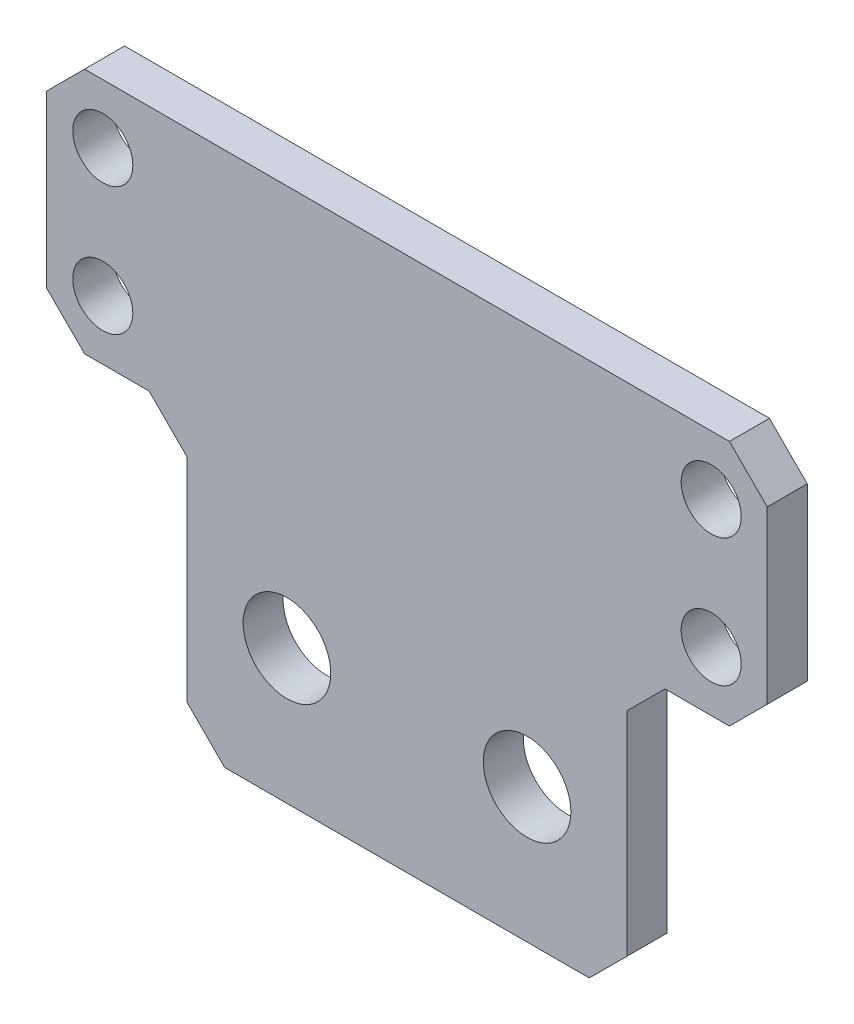
from build123d import *

# Parameters (mm, degrees)
SKETCH1_R           = 3.475
SKETCH1_R_2         = 2.3828
BOSS_EXTRUDE1_DEPTH = 3.175
CHAMFER1_SIZE       = 3
CHAMFER2_SIZE       = 3


with BuildPart() as part:
    # Sketch1 → Boss-Extrude1 (new body)
    with BuildSketch(Plane.XY):
        Polygon((17.4625, -21.209), (-17.4625, -21.209), (-17.4625, 1.651), (-28.575, 1.651), (-28.575, 21.209), (28.575, 21.209), (28.575, 1.651), (17.4625, 1.651), align=None)
        with Locations((-9.525, -10.541)):
            Circle(SKETCH1_R, mode=Mode.SUBTRACT)
        with Locations((9.525, -10.541)):
            Circle(SKETCH1_R, mode=Mode.SUBTRACT)
        with Locations((-24.13, 6.35)):
            Circle(SKETCH1_R_2, mode=Mode.SUBTRACT)
        with Locations((-24.13, 16.51)):
            Circle(SKETCH1_R_2, mode=Mode.SUBTRACT)
        with Locations((24.13, 16.51)):
            Circle(SKETCH1_R_2, mode=Mode.SUBTRACT)
        with Locations((24.13, 6.35)):
            Circle(SKETCH1_R_2, mode=Mode.SUBTRACT)
    extrude(amount=BOSS_EXTRUDE1_DEPTH)

    # Chamfer1
    chamfer1_edges = [part.edges().sort_by_distance(p)[0] for p in [
        (-28.575, 1.651, 1.5875),
        (-28.575, 21.209, 1.5875),
        (28.575, 21.209, 1.5875),
        (28.575, 1.651, 1.5875),
    ]]
    chamfer(chamfer1_edges, length=CHAMFER1_SIZE)

    # Chamfer2
    chamfer2_edges = [part.edges().sort_by_distance(p)[0] for p in [
        (17.4625, 1.651, 1.5875),
        (17.4625, -21.209, 1.5875),
        (-17.4625, -21.209, 1.5875),
        (-17.4625, 1.651, 1.5875),
    ]]
    chamfer(chamfer2_edges, length=CHAMFER2_SIZE)


solid = part.part
